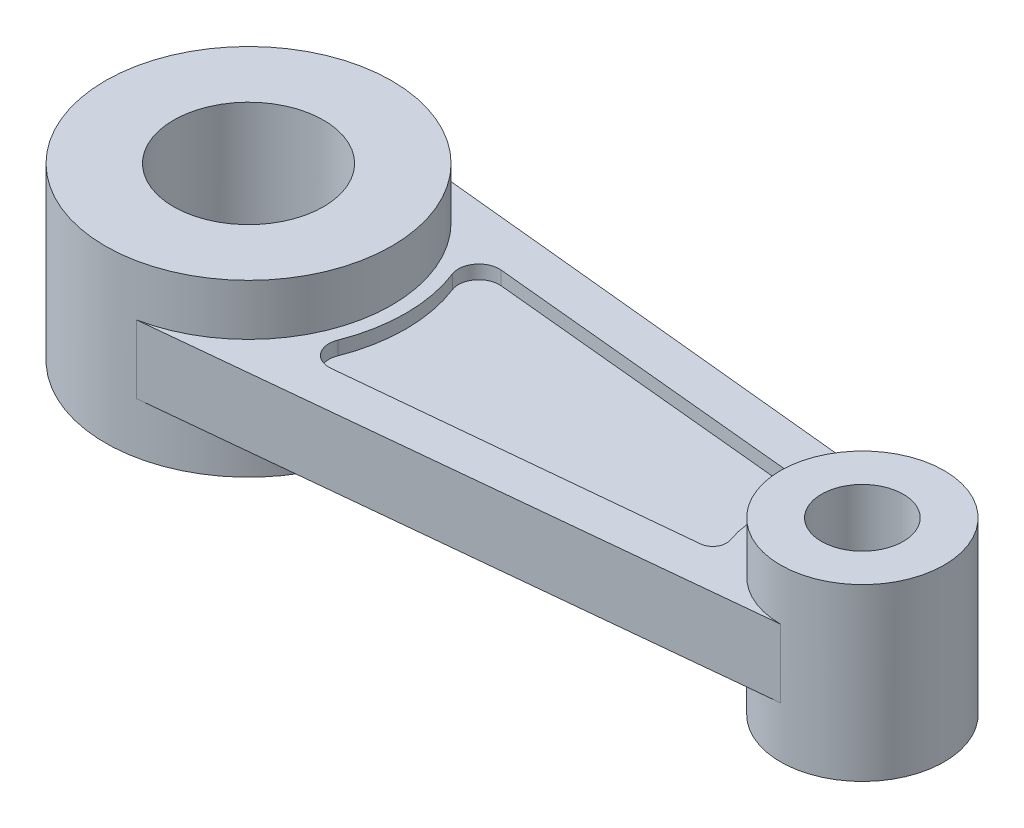
from build123d import *

# Parameters (mm, degrees)
BOSS_EXTRUDE1_DEPTH = 5
SKETCH2_R           = 21
BOSS_EXTRUDE3_DEPTH = 7.5
SKETCH3_R           = 12
BOSS_EXTRUDE4_DEPTH = 7.5
SKETCH4_R           = 21
BOSS_EXTRUDE6_DEPTH = 7.5
SKETCH5_R           = 12
BOSS_EXTRUDE7_DEPTH = 7.5
SKETCH6_R           = 11
CUT_EXTRUDE1_DEPTH  = 69
SKETCH7_R           = 6
CUT_EXTRUDE2_DEPTH  = 69
CUT_EXTRUDE4_DEPTH  = 2
CUT_EXTRUDE5_DEPTH  = 2


with BuildPart() as part:
    # Sketch1 → Boss-Extrude1 (new, symmetric)
    with BuildSketch(Plane(origin=(0, 0, 0), x_dir=(1, 0, 0), z_dir=(0, 1, 0))):
        Polygon((90, -12), (0, -21), (0, 21), (90, 12), align=None)
    extrude(amount=BOSS_EXTRUDE1_DEPTH, both=True)

    # Sketch2 → Boss-Extrude3 (add, symmetric)
    with BuildSketch(Plane(origin=(0, 5, 0), x_dir=(1, 0, 0), z_dir=(0, 1, 0))):
        with Locations(Location((0, 0, 0), (0, 0, 270))):
            Circle(SKETCH2_R)
    extrude(amount=BOSS_EXTRUDE3_DEPTH, both=True)

    # Sketch3 → Boss-Extrude4 (add, symmetric)
    with BuildSketch(Plane(origin=(0, 5, 0), x_dir=(1, 0, 0), z_dir=(0, 1, 0))):
        with Locations(Location((90, 0, 0), (0, 0, 270))):
            Circle(SKETCH3_R)
    extrude(amount=BOSS_EXTRUDE4_DEPTH, both=True)

    # Sketch4 → Boss-Extrude6 (add, symmetric)
    with BuildSketch(Plane.XZ.offset(5)):
        with Locations(Location((0, 0, 0), (0, 0, 270))):
            Circle(SKETCH4_R)
    extrude(amount=BOSS_EXTRUDE6_DEPTH, both=True)

    # Sketch5 → Boss-Extrude7 (add, symmetric)
    with BuildSketch(Plane.XZ.offset(5)):
        with Locations(Location((90, 0, 0), (0, 0, 270))):
            Circle(SKETCH5_R)
    extrude(amount=BOSS_EXTRUDE7_DEPTH, both=True)

    # Sketch6 → Cut-Extrude1 (cut)
    with BuildSketch(Plane(origin=(0, 12.5, 0), x_dir=(1, 0, 0), z_dir=(0, 1, 0))):
        with Locations(Location((0, 0, 0), (0, 0, 270))):
            Circle(SKETCH6_R)
    extrude(amount=-CUT_EXTRUDE1_DEPTH, mode=Mode.SUBTRACT)

    # Sketch7 → Cut-Extrude2 (cut)
    with BuildSketch(Plane(origin=(0, 12.5, 0), x_dir=(1, 0, 0), z_dir=(0, 1, 0))):
        with Locations(Location((90, 0, 0), (0, 0, 270))):
            Circle(SKETCH7_R)
    extrude(amount=-CUT_EXTRUDE2_DEPTH, mode=Mode.SUBTRACT)

    # Sketch8 → Cut-Extrude4 (cut)
    with BuildSketch(Plane(origin=(0, 5, 0), x_dir=(1, 0, 0), z_dir=(0, 1, 0))):
        with BuildLine():
            Line((24.562692553, 12.477391073), (73.943240769, 7.677349154))
            ThreePointArc((73.943240769, 7.677349154), (75.435017265, 6.76369448), (75.637490363, 5.026119554))
            ThreePointArc((75.637490363, 5.026119554), (74.783444514, 0), (75.637490363, -5.026119554))
            ThreePointArc((75.637490363, -5.026119554), (75.435017265, -6.76369448), (73.943240769, -7.677349154))
            Line((73.943240769, -7.677349154), (24.562692553, -12.477391073))
            ThreePointArc((24.562692553, -12.477391073), (21.879607854, -11.300975456), (21.478465069, -8.398910386))
            ThreePointArc((21.478465069, -8.398910386), (23.062223601, 0), (21.478465069, 8.398910386))
            ThreePointArc((21.478465069, 8.398910386), (21.879607854, 11.300975456), (24.562692553, 12.477391073))
        make_face()
    extrude(amount=-CUT_EXTRUDE4_DEPTH, mode=Mode.SUBTRACT)

    # Sketch9 → Cut-Extrude5 (cut)
    with BuildSketch(Plane.XZ.offset(5)):
        with BuildLine():
            Line((75.653851905, 8.117723123), (25.352219693, 12.951931944))
            ThreePointArc((25.352219693, 12.951931944), (22.666288444, 11.767102867), (22.27748823, 8.857312323))
            ThreePointArc((22.27748823, 8.857312323), (23.973703582, 0), (22.27748823, -8.857312323))
            ThreePointArc((22.27748823, -8.857312323), (22.666288444, -11.767102867), (25.352219693, -12.951931944))
            Line((25.352219693, -12.951931944), (75.653851905, -8.117723123))
            ThreePointArc((75.653851905, -8.117723123), (77.179932686, -7.151839338), (77.305529846, -5.35015141))
            ThreePointArc((77.305529846, -5.35015141), (76.224162726, 0), (77.305529846, 5.35015141))
            ThreePointArc((77.305529846, 5.35015141), (77.179932686, 7.151839338), (75.653851905, 8.117723123))
        make_face()
    extrude(amount=-CUT_EXTRUDE5_DEPTH, mode=Mode.SUBTRACT)


solid = part.part
